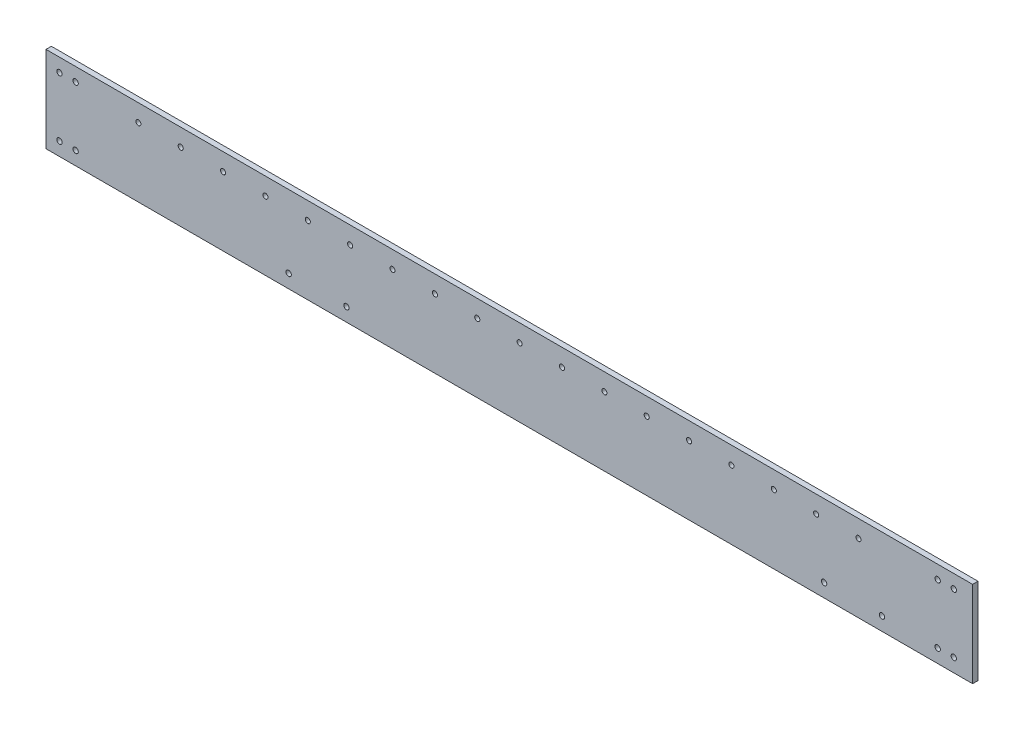
from build123d import *

# Parameters (mm, degrees)
SKETCH1_W                    = 3.175
SKETCH1_H                    = 50.8
BOSS_EXTRUDE1_DEPTH          = 546.825
SIDEHOLES_SKETCH4_R          = 1.5875
SIDEHOLES_SKETCH4_R_2        = 1.5
SIDEHOLES_CUT_EXTRUDE3_DEPTH = 550.1887665


with BuildPart() as part:
    # Sketch1 → Boss-Extrude1 (new body)
    with BuildSketch(Plane(origin=(0, 0, 0), x_dir=(0, 0, -1), z_dir=(1, 0, 0))):
        with Locations((-1.5875, 25.4)):
            Rectangle(SKETCH1_W, SKETCH1_H)
    extrude(amount=BOSS_EXTRUDE1_DEPTH)

    # SideHoles-Sketch4 → SideHoles-Cut-Extrude3 (cut, through all)
    with BuildSketch(Plane.XY.offset(3.175)):
        with Locations((7.9375, 42.8625)):
            Circle(SIDEHOLES_SKETCH4_R)
        with Locations((526.1875, 42.8625)):
            Circle(SIDEHOLES_SKETCH4_R)
        with Locations((17.4625, 42.8625)):
            Circle(SIDEHOLES_SKETCH4_R)
        with Locations((535.7125, 42.8625)):
            Circle(SIDEHOLES_SKETCH4_R)
        with Locations((7.9375, 7.9375)):
            Circle(SIDEHOLES_SKETCH4_R)
        with Locations((17.4625, 7.9375)):
            Circle(SIDEHOLES_SKETCH4_R)
        with Locations((526.1875, 7.9375)):
            Circle(SIDEHOLES_SKETCH4_R)
        with Locations((535.7125, 7.9375)):
            Circle(SIDEHOLES_SKETCH4_R)
        with Locations((54.5, 40.575)):
            Circle(SIDEHOLES_SKETCH4_R_2)
        with Locations((79.5, 40.575)):
            Circle(SIDEHOLES_SKETCH4_R_2)
        with Locations((104.5, 40.575)):
            Circle(SIDEHOLES_SKETCH4_R_2)
        with Locations((129.5, 40.575)):
            Circle(SIDEHOLES_SKETCH4_R_2)
        with Locations((154.5, 40.575)):
            Circle(SIDEHOLES_SKETCH4_R_2)
        with Locations((179.5, 40.575)):
            Circle(SIDEHOLES_SKETCH4_R_2)
        with Locations((204.5, 40.575)):
            Circle(SIDEHOLES_SKETCH4_R_2)
        with Locations((229.5, 40.575)):
            Circle(SIDEHOLES_SKETCH4_R_2)
        with Locations((254.5, 40.575)):
            Circle(SIDEHOLES_SKETCH4_R_2)
        with Locations((279.5, 40.575)):
            Circle(SIDEHOLES_SKETCH4_R_2)
        with Locations((304.5, 40.575)):
            Circle(SIDEHOLES_SKETCH4_R_2)
        with Locations((329.5, 40.575)):
            Circle(SIDEHOLES_SKETCH4_R_2)
        with Locations((354.5, 40.575)):
            Circle(SIDEHOLES_SKETCH4_R_2)
        with Locations((379.5, 40.575)):
            Circle(SIDEHOLES_SKETCH4_R_2)
        with Locations((493.3125, 7.9375)):
            Circle(SIDEHOLES_SKETCH4_R)
        with Locations((177.3125, 7.9375)):
            Circle(SIDEHOLES_SKETCH4_R)
        with Locations((404.5, 40.575)):
            Circle(SIDEHOLES_SKETCH4_R_2)
        with Locations((429.5, 40.575)):
            Circle(SIDEHOLES_SKETCH4_R_2)
        with Locations((454.5, 40.575)):
            Circle(SIDEHOLES_SKETCH4_R_2)
        with Locations((479.5, 40.575)):
            Circle(SIDEHOLES_SKETCH4_R_2)
        with Locations((143.1875, 7.9375)):
            Circle(SIDEHOLES_SKETCH4_R)
        with Locations((459.1875, 7.9375)):
            Circle(SIDEHOLES_SKETCH4_R)
    extrude(amount=-SIDEHOLES_CUT_EXTRUDE3_DEPTH, mode=Mode.SUBTRACT)


solid = part.part
